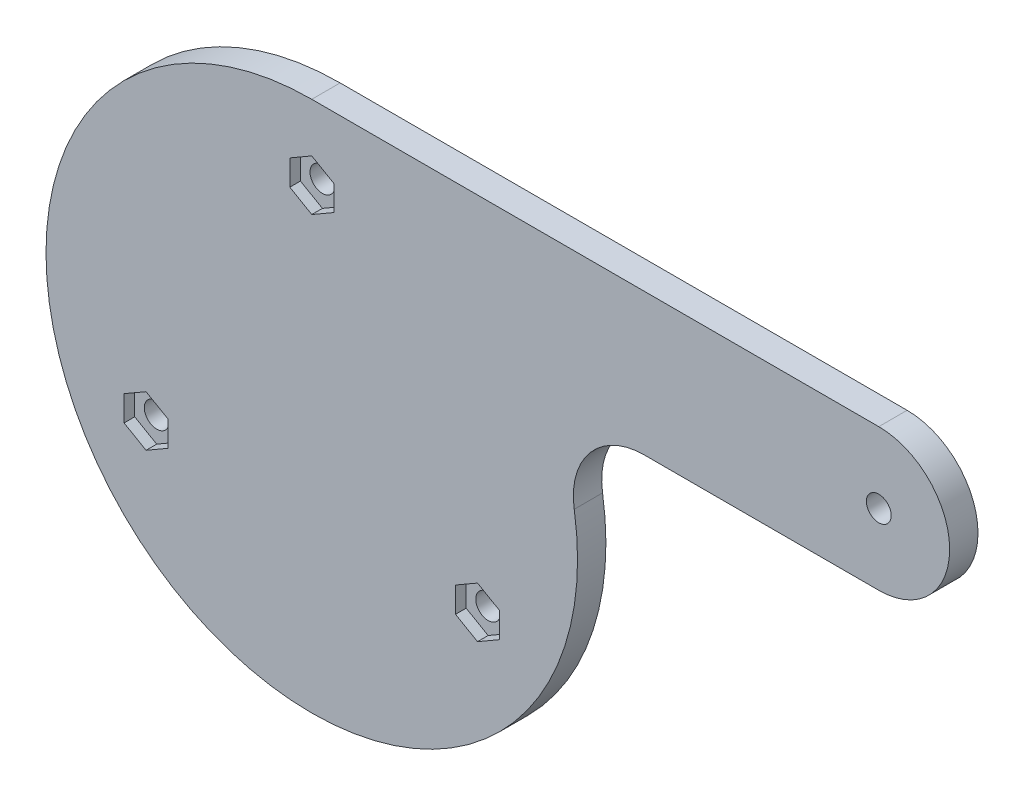
from build123d import *

# Parameters (mm, degrees)
BOSS_EXTRUDE1_DEPTH = 4
CUT_EXTRUDE1_DEPTH  = 1.5
SKETCH4_R           = 1.75
CUT_EXTRUDE3_DEPTH  = 17.5
SKETCH5_R           = 1.75
CUT_EXTRUDE4_DEPTH  = 17.5


with BuildPart() as part:
    # Sketch2 → Boss-Extrude1 (new body)
    with BuildSketch(Plane.XY):
        with BuildLine():
            Line((80, 37.5), (0, 37.5))
            ThreePointArc((0, 37.5), (-34.824248161, -13.911209149), (25.837194647, -27.178840534))
            ThreePointArc((25.837194647, -27.178840534), (35.524064233, -12.01211307), (37.029598104, 5.921052632))
            ThreePointArc((37.029598104, 5.921052632), (39.295298496, 13.988856845), (46.904157598, 17.5))
            Line((46.904157598, 17.5), (80, 17.5))
            ThreePointArc((80, 17.5), (90, 27.5), (80, 37.5))
        make_face()
    extrude(amount=BOSS_EXTRUDE1_DEPTH)

    # Sketch3 → Cut-Extrude1 (cut)
    with BuildSketch(Plane.XY.offset(4)):
        Polygon((26.483056848, -15.29), (26.483056848, -11.71), (23.382685902, -9.92), (20.282314957, -11.71), (20.282314957, -15.29), (23.382685902, -17.08), align=None)
        Polygon((0, 30.58), (-3.100370946, 28.79), (-3.100370946, 25.21), (0, 23.42), (3.100370946, 25.21), (3.100370946, 28.79), align=None)
        Polygon((-26.483056848, -15.29), (-23.382685902, -17.08), (-20.282314957, -15.29), (-20.282314957, -11.71), (-23.382685902, -9.92), (-26.483056848, -11.71), align=None)
    extrude(amount=-CUT_EXTRUDE1_DEPTH, mode=Mode.SUBTRACT)

    # Sketch4 → Cut-Extrude3 (cut)
    with BuildSketch(Plane.XY.offset(4)):
        with Locations((0, 27)):
            Circle(SKETCH4_R)
        with Locations((23.382685902, -13.5)):
            Circle(SKETCH4_R)
        with Locations((-23.382685902, -13.5)):
            Circle(SKETCH4_R)
    extrude(amount=-CUT_EXTRUDE3_DEPTH, mode=Mode.SUBTRACT)

    # Sketch5 → Cut-Extrude4 (cut)
    with BuildSketch(Plane.XY.offset(4)):
        with Locations((80, 27.5)):
            Circle(SKETCH5_R)
    extrude(amount=-CUT_EXTRUDE4_DEPTH, mode=Mode.SUBTRACT)


solid = part.part
